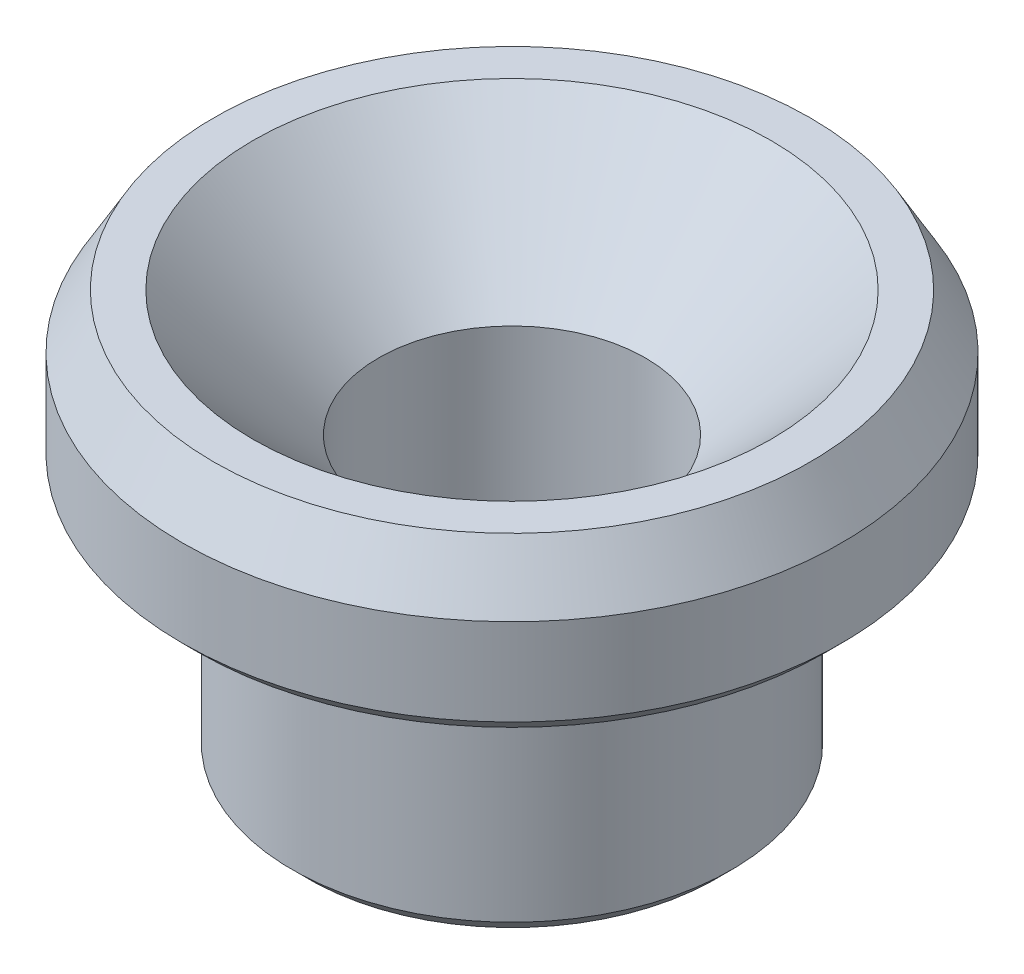
from build123d import *

# Parameters (mm, degrees)
CHAMFER1_SIZE  = 1
CHAMFER1_SIZE2 = 1.732050808
CHAMFER2_SIZE  = 0.5


with BuildPart() as part:
    # Sketch1 → Revolve1 (revolve)
    with BuildSketch(Plane.XY, mode=Mode.PRIVATE) as revolve1_sk:
        Polygon((4.25, 0), (4.25, 9), (8.25, 13), (10.5, 13), (10.5, 8), (7, 8), (7, 0), align=None)
    revolve(revolve1_sk.sketch.rotate(Axis((0, 0, 0), (0, 1, 0)), 90), axis=Axis((0, 0, 0), (0, 1, 0)))

    # Chamfer1
    chamfer1_edges = [part.edges().sort_by_distance(p)[0] for p in [
        (0, 13, 10.5),
    ]]
    chamfer1_side = [part.faces().sort_by_distance(p)[0] for p in [
        (0, 13, 8.546984848),
    ]]
    chamfer(chamfer1_edges, length=CHAMFER1_SIZE, length2=CHAMFER1_SIZE2, reference=chamfer1_side[0])

    # Chamfer2
    chamfer2_edges = [part.edges().sort_by_distance(p)[0] for p in [
        (0, 0, 7),
        (0, 8, 10.5),
    ]]
    chamfer(chamfer2_edges, length=CHAMFER2_SIZE)


solid = part.part
